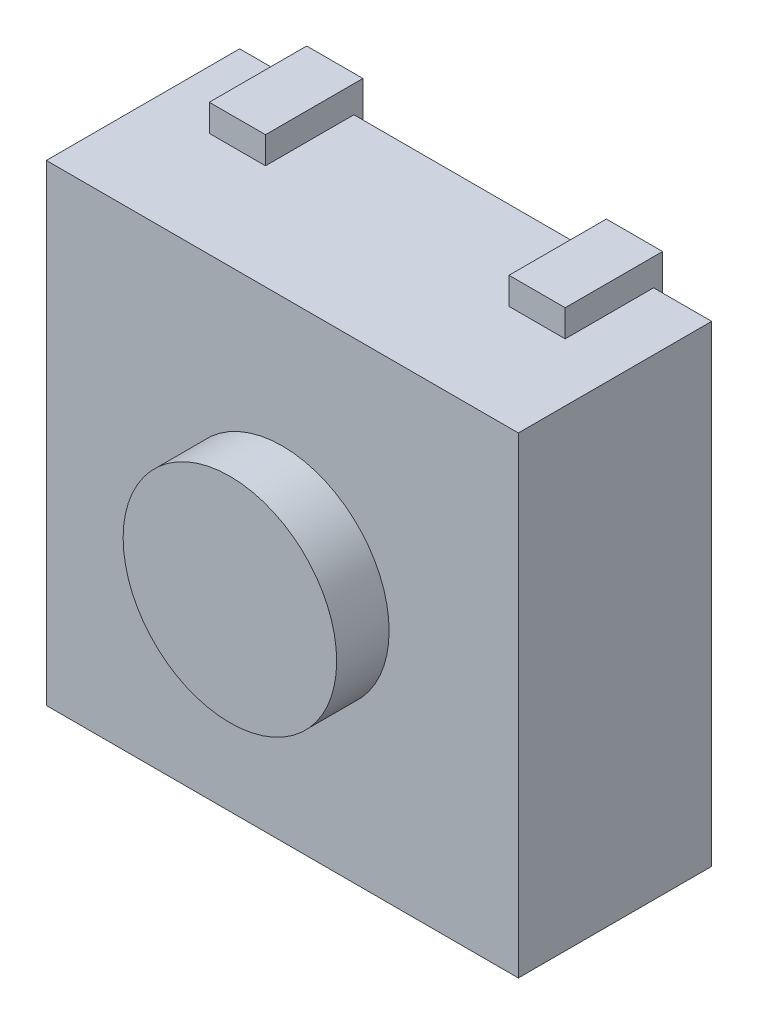
from build123d import *

# Parameters (mm, degrees)
SKIZZE1_W                                  = 6.3
SKIZZE1_H                                  = 6.3
AUFSATZ_LINEAR_AUSTRAGEN1_DEPTH            = 2.7
SKIZZE2_R                                  = 1.425
AUFSATZ_LINEAR_AUSTRAGEN2_DEPTH            = 3.4
FL_CHE_VERSCHIEBEN1_BY                     = 0.12
SKIZZE3_W                                  = 0.75
SKIZZE3_H                                  = 1.61
AUFSATZ_LINEAR_AUSTRAGEN3_DEPTH            = 1.3
SPIEGELN1_AT_THE_SECOND_PLANE_COPY_1_SKE_W = 0.75
SPIEGELN1_AT_THE_SECOND_PLANE_COPY_1_SKE_H = 1.61
SPIEGELN1_AT_THE_SECOND_PLANE_COPY_1_DEPTH = 1.3


with BuildPart() as part:
    # Skizze1 → Aufsatz-Linear austragen1 (new body)
    with BuildSketch(Plane.XY):
        Rectangle(SKIZZE1_W, SKIZZE1_H)
    extrude(amount=AUFSATZ_LINEAR_AUSTRAGEN1_DEPTH)

    # Skizze2 → Aufsatz-Linear austragen2 (add)
    with BuildSketch(Plane.XY):
        with Locations(Location((0, 0, 0), (0, 0, 180))):
            Circle(SKIZZE2_R)
    extrude(amount=AUFSATZ_LINEAR_AUSTRAGEN2_DEPTH)

    # Fläche verschieben1: a face moved inward by 0.12
    extrude(part.faces().sort_by_distance((0, 0, 0))[0], amount=FL_CHE_VERSCHIEBEN1_BY, dir=(0, 0, 1), mode=Mode.SUBTRACT)

    # Skizze3 → Aufsatz-Linear austragen3 (add)
    with BuildSketch(Plane.XY):
        with Locations((-2, 2.705)):
            Rectangle(SKIZZE3_W, SKIZZE3_H)
    aufsatz_linear_austragen3 = extrude(amount=AUFSATZ_LINEAR_AUSTRAGEN3_DEPTH)

    # Spiegeln1: Aufsatz-Linear austragen3 across plane
    add(aufsatz_linear_austragen3.mirror(Plane.ZX))

    # Spiegeln1 at the second plane: Aufsatz-Linear austragen3 across plane
    add(aufsatz_linear_austragen3.mirror(Plane(origin=(0, 0, 0), x_dir=(0, 0, 1), z_dir=(1, 0, 0))))

    # Spiegeln1 at the second plane copy 1 ske → Spiegeln1 at the second plane copy 1 (add)
    with BuildSketch(Plane(origin=(0, 0, 0), x_dir=(-1, 0, 0), z_dir=(0, 0, 1))):
        with Locations((-2, 2.705)):
            Rectangle(SPIEGELN1_AT_THE_SECOND_PLANE_COPY_1_SKE_W, SPIEGELN1_AT_THE_SECOND_PLANE_COPY_1_SKE_H)
    extrude(amount=SPIEGELN1_AT_THE_SECOND_PLANE_COPY_1_DEPTH)


solid = part.part
